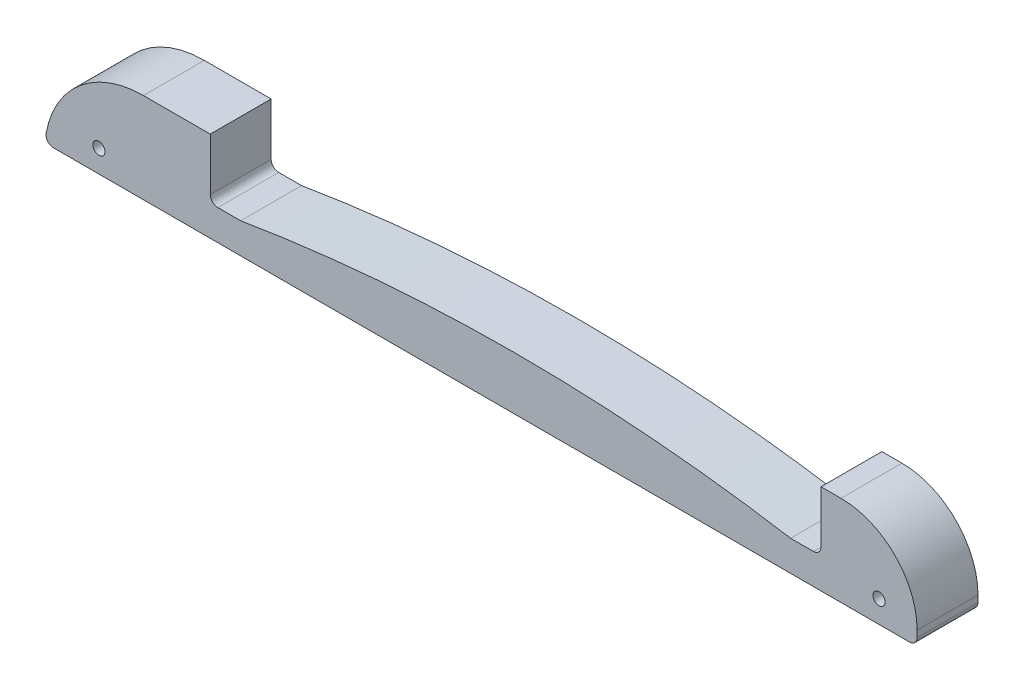
from build123d import *

# Parameters (mm, degrees)
MODEL_R            = 0.5
EXTRUDE_1077_DEPTH = 8
FILLET_1_R         = 10
FILLET_2_R         = 1
HOLE_WIZARD_M2_D   = 1.6


with BuildPart() as part:
    # Model → Extrude 1077 (new body)
    with BuildSketch(Plane.XY):
        with BuildLine():
            Line((-32.875, 4), (-32.875, 11.86))
            Line((-32.875, 11.86), (-41.650081081, 11.86))
            ThreePointArc((-41.650081081, 11.86), (-50.430172197, 8.446970324), (-54.6, 0))
            Line((-54.6, 0), (0, 0))
            Line((0, 0), (60, 0))
            Line((60, 0), (60, 11.86))
            Line((60, 11.86), (47.375, 11.86))
            Line((47.375, 11.86), (47.375, 4))
            Line((47.375, 4), (43.375, 4))
            ThreePointArc((43.375, 4), (7.25, 6.986211556), (-28.875, 4))
            Line((-28.875, 4), (-32.875, 4))
        make_face()
        with Locations((-47.5, 2.93)):
            Circle(MODEL_R, mode=Mode.SUBTRACT)
        with Locations((55, 2.93)):
            Circle(MODEL_R, mode=Mode.SUBTRACT)
    extrude(amount=-EXTRUDE_1077_DEPTH)

    # Скругление1
    fillet_1_edges = [part.edges().sort_by_distance(p)[0] for p in [
        (60, 11.86, -4),
    ]]
    fillet(fillet_1_edges, radius=FILLET_1_R)

    # Скругление2
    fillet_2_edges = [part.edges().sort_by_distance(p)[0] for p in [
        (-54.6, 0, -4),
        (-32.875, 4, -4),
        (47.375, 4, -4),
        (60, 0, -4),
    ]]
    fillet(fillet_2_edges, radius=FILLET_2_R)

    # Крепление M2 (through all)
    with Locations(Plane.XY):
        with Locations((-47.5, 2.93), (55, 2.93)):
            Hole(HOLE_WIZARD_M2_D / 2)


solid = part.part
